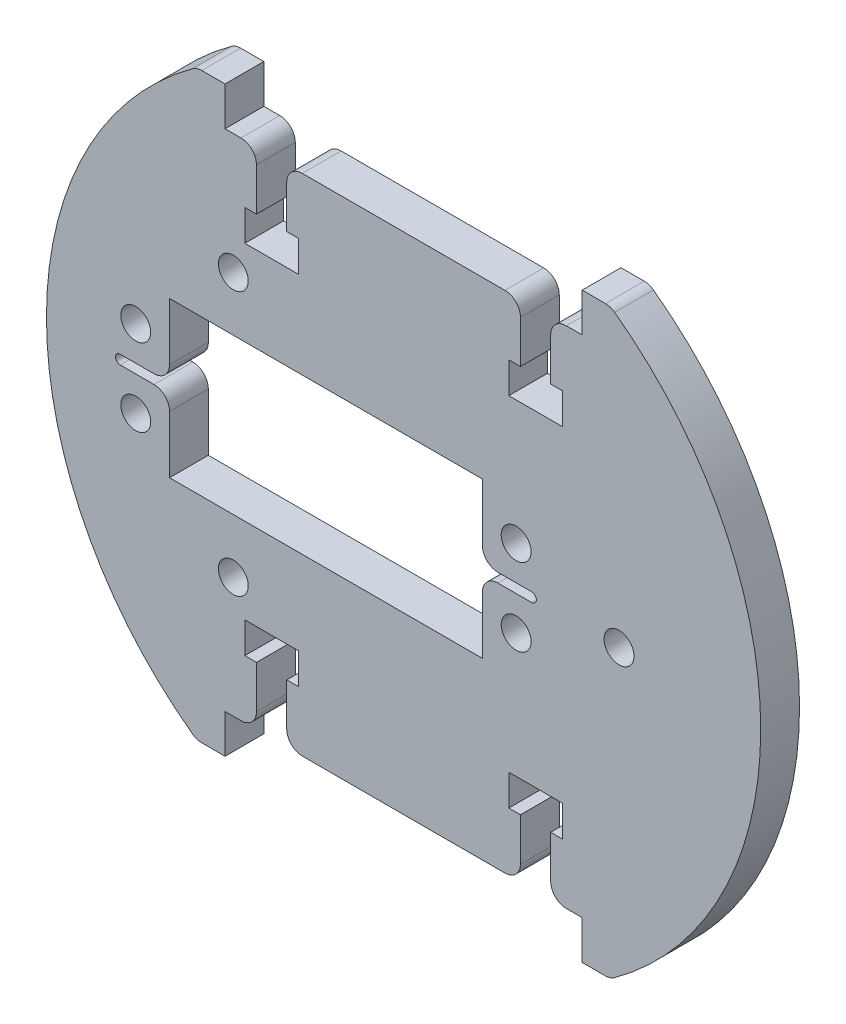
from build123d import *

# Parameters (mm, degrees)
ESQUISSE1_R        = 1.925
BOSS_EXTRU_1_DEPTH = 5


with BuildPart() as part:
    # Esquisse1 → Boss.-Extru.1 (new body)
    with BuildSketch(Plane.XY):
        with BuildLine():
            Line((13.05, 32.5), (-13.05, 32.5))
            ThreePointArc((-13.05, 32.5), (-14.464213562, 31.914213562), (-15.05, 30.5))
            Line((-15.05, 30.5), (-15.05, 25))
            Line((-15.05, 25), (-13.55, 25))
            Line((-13.55, 25), (-13.55, 21))
            Line((-13.55, 21), (-20.45, 21))
            Line((-20.45, 21), (-20.45, 25))
            Line((-20.45, 25), (-18.95, 25))
            Line((-18.95, 25), (-18.95, 30.5))
            ThreePointArc((-18.95, 30.5), (-19.535786438, 31.914213562), (-20.95, 32.5))
            Line((-20.95, 32.5), (-23, 32.5))
            Line((-23, 32.5), (-23, 37.5))
            Line((-23, 37.5), (-25.999999067, 37.497633905))
            ThreePointArc((-25.999999067, 37.497633905), (-26.620839292, 37.398317642), (-27.180168114, 37.111163374))
            ThreePointArc((-27.180168114, 37.111163374), (-45.999999844, 0), (-27.180168114, -37.111163374))
            ThreePointArc((-27.180168114, -37.111163374), (-26.620839292, -37.398317642), (-25.999999067, -37.497633905))
            Line((-25.999999067, -37.497633905), (-23, -37.5))
            Line((-23, -37.5), (-23, -32.5))
            Line((-23, -32.5), (-20.95, -32.5))
            ThreePointArc((-20.95, -32.5), (-19.535786438, -31.914213562), (-18.95, -30.5))
            Line((-18.95, -30.5), (-18.95, -25))
            Line((-18.95, -25), (-20.45, -25))
            Line((-20.45, -25), (-20.45, -21))
            Line((-20.45, -21), (-13.55, -21))
            Line((-13.55, -21), (-13.55, -25))
            Line((-13.55, -25), (-15.05, -25))
            Line((-15.05, -25), (-15.05, -30.5))
            ThreePointArc((-15.05, -30.5), (-14.464213562, -31.914213562), (-13.05, -32.5))
            Line((-13.05, -32.5), (13.05, -32.5))
            ThreePointArc((13.05, -32.5), (14.464213562, -31.914213562), (15.05, -30.5))
            Line((15.05, -30.5), (15.05, -25))
            Line((15.05, -25), (13.55, -25))
            Line((13.55, -25), (13.55, -21))
            Line((13.55, -21), (20.45, -21))
            Line((20.45, -21), (20.45, -25))
            Line((20.45, -25), (18.95, -25))
            Line((18.95, -25), (18.95, -30.5))
            ThreePointArc((18.95, -30.5), (19.535786438, -31.914213562), (20.95, -32.5))
            Line((20.95, -32.5), (23, -32.5))
            Line((23, -32.5), (23, -37.5))
            Line((23, -37.5), (25.999999067, -37.497633905))
            ThreePointArc((25.999999067, -37.497633905), (26.620839292, -37.398317642), (27.180168114, -37.111163374))
            ThreePointArc((27.180168114, -37.111163374), (45.999999844, 0), (27.180168114, 37.111163374))
            ThreePointArc((27.180168114, 37.111163374), (26.620839292, 37.398317642), (25.999999067, 37.497633905))
            Line((25.999999067, 37.497633905), (23, 37.5))
            Line((23, 37.5), (23, 32.5))
            Line((23, 32.5), (20.95, 32.5))
            ThreePointArc((20.95, 32.5), (19.535786438, 31.914213562), (18.95, 30.5))
            Line((18.95, 30.5), (18.95, 25))
            Line((18.95, 25), (20.45, 25))
            Line((20.45, 25), (20.45, 21))
            Line((20.45, 21), (13.55, 21))
            Line((13.55, 21), (13.55, 25))
            Line((13.55, 25), (15.05, 25))
            Line((15.05, 25), (15.05, 30.5))
            ThreePointArc((15.05, 30.5), (14.464213562, 31.914213562), (13.05, 32.5))
        make_face()
        with Locations((27.75, 0)):
            Circle(ESQUISSE1_R, mode=Mode.SUBTRACT)
        with Locations((-21.933137835, -17)):
            Circle(ESQUISSE1_R, mode=Mode.SUBTRACT)
        with Locations((-21.933137835, 17)):
            Circle(ESQUISSE1_R, mode=Mode.SUBTRACT)
        with Locations((14.500000149, -5)):
            Circle(ESQUISSE1_R, mode=Mode.SUBTRACT)
        with Locations((14.500000149, 5)):
            Circle(ESQUISSE1_R, mode=Mode.SUBTRACT)
        with Locations((-34.499999851, -5)):
            Circle(ESQUISSE1_R, mode=Mode.SUBTRACT)
        with Locations((-34.499999851, 5)):
            Circle(ESQUISSE1_R, mode=Mode.SUBTRACT)
        with BuildLine():
            Line((10.150000149, -10), (10.150000149, -2.6))
            ThreePointArc((10.150000149, -2.6), (10.735786586, -1.185786438), (12.150000149, -0.6))
            Line((12.150000149, -0.6), (16.500000149, -0.6))
            ThreePointArc((16.500000149, -0.6), (17.100000149, 0), (16.500000149, 0.6))
            Line((16.500000149, 0.6), (12.150000149, 0.6))
            ThreePointArc((12.150000149, 0.6), (10.735786586, 1.185786438), (10.150000149, 2.6))
            Line((10.150000149, 2.6), (10.150000149, 10))
            Line((10.150000149, 10), (-30.149999851, 10))
            Line((-30.149999851, 10), (-30.149999851, 2.6))
            ThreePointArc((-30.149999851, 2.6), (-30.735786289, 1.185786438), (-32.149999851, 0.6))
            Line((-32.149999851, 0.6), (-36.499999851, 0.6))
            ThreePointArc((-36.499999851, 0.6), (-37.099999851, 0), (-36.499999851, -0.6))
            Line((-36.499999851, -0.6), (-32.149999851, -0.6))
            ThreePointArc((-32.149999851, -0.6), (-30.735786289, -1.185786438), (-30.149999851, -2.6))
            Line((-30.149999851, -2.6), (-30.149999851, -10))
            Line((-30.149999851, -10), (10.150000149, -10))
        make_face(mode=Mode.SUBTRACT)
    extrude(amount=BOSS_EXTRU_1_DEPTH)


solid = part.part
